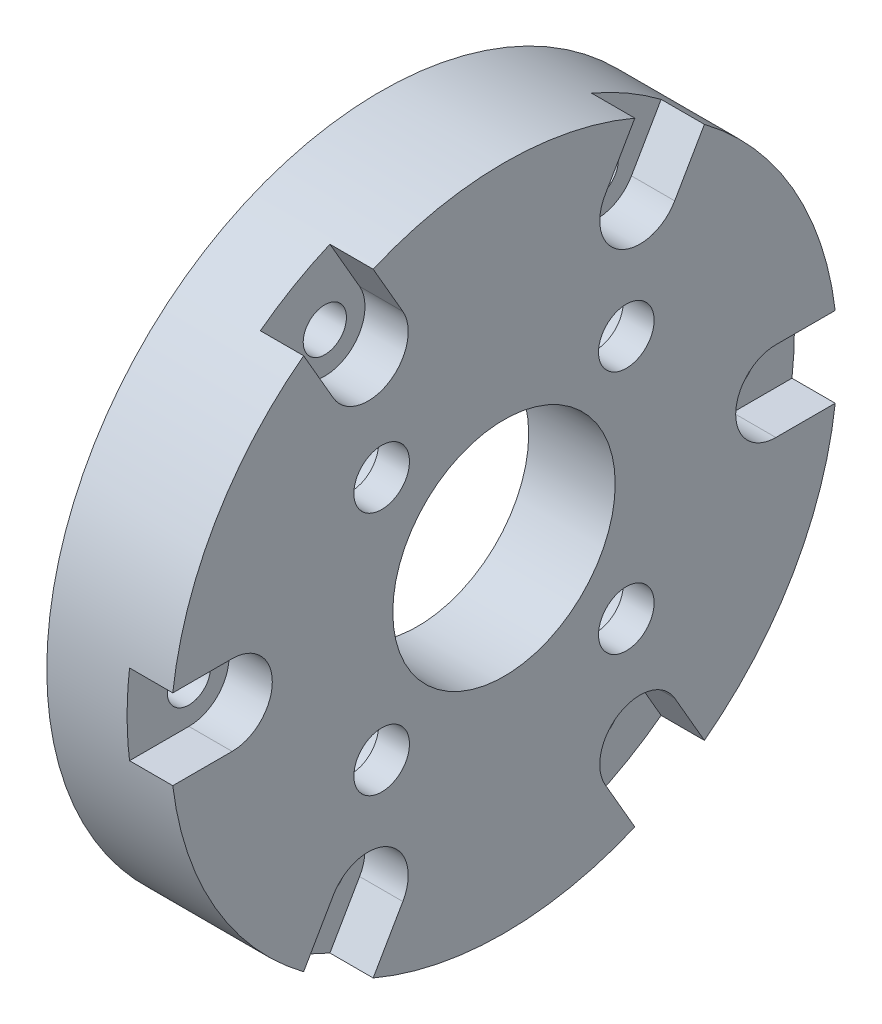
from build123d import *

# Parameters (mm, degrees)
ENL_V_MAT_EXTRU_1_DEPTH                         = 3.5
R_P_TITION_CIRCULAIRE1_COUNT                    = 6
ESQUISSE3_R                                     = 1.75
ENL_V_MAT_EXTRU_2_DEPTH                         = 39.733060814
R_P_TITION_CIRCULAIRE2_COUNT                    = 6
CHAMBRAGE_POUR_VIS_T_TE_CYLINDRIQUE_D           = 4.5
CHAMBRAGE_POUR_VIS_T_TE_CYLINDRIQUE_CBORE_D     = 8
CHAMBRAGE_POUR_VIS_T_TE_CYLINDRIQUE_CBORE_DEPTH = 4.5
R_P_TITION_CIRCULAIRE3_COUNT                    = 4


with BuildPart() as part:
    # Esquisse1 → Base-Révolution (revolve)
    with BuildSketch(Plane.XY, mode=Mode.PRIVATE) as base_r_volution_sk:
        Polygon((-5, 27), (-5, 19), (-2, 19), (-2, 9), (5, 9), (5, 27), align=None)
    revolve(base_r_volution_sk.sketch.rotate(Axis((-14.936373376, 0, 0), (1, 0, 0)), 90), axis=Axis((-14.936373376, 0, 0), (1, 0, 0)))

    # Esquisse2 → Enlèv. mat.-Extru.1 (cut)
    with BuildSketch(Plane(origin=(5, 0, 0), x_dir=(0, 0, -1), z_dir=(1, 0, 0))):
        with BuildLine():
            Line((-22, 3.25), (-28.543286321, 3.25))
            Line((-28.543286321, 3.25), (-28.543286321, -3.25))
            Line((-28.543286321, -3.25), (-22, -3.25))
            ThreePointArc((-22, -3.25), (-18.75, 0), (-22, 3.25))
        make_face()
    enl_v_mat_extru_1 = extrude(amount=-ENL_V_MAT_EXTRU_1_DEPTH, mode=Mode.SUBTRACT)

    # Répétition circulaire1: Enlèv. mat.-Extru.1 ×6 about axis
    r_p_tition_circulaire1_axis = Axis((0, 0, 0), (1, 0, 0))
    for i in range(1, R_P_TITION_CIRCULAIRE1_COUNT):
        add(enl_v_mat_extru_1.rotate(r_p_tition_circulaire1_axis, i * 360 / R_P_TITION_CIRCULAIRE1_COUNT), mode=Mode.SUBTRACT)

    # Esquisse3 → Enlèv. mat.-Extru.2 (cut, through all)
    with BuildSketch(Plane(origin=(1.5, 0, 0), x_dir=(0, 0, -1), z_dir=(1, 0, 0))):
        with Locations((-22, 0)):
            Circle(ESQUISSE3_R)
    enl_v_mat_extru_2 = extrude(amount=-ENL_V_MAT_EXTRU_2_DEPTH, mode=Mode.SUBTRACT)

    # Répétition circulaire2: Enlèv. mat.-Extru.2 ×6 about axis
    r_p_tition_circulaire2_axis = Axis((0, 0, 0), (1, 0, 0))
    for i in range(1, R_P_TITION_CIRCULAIRE2_COUNT):
        add(enl_v_mat_extru_2.rotate(r_p_tition_circulaire2_axis, i * 360 / R_P_TITION_CIRCULAIRE2_COUNT), mode=Mode.SUBTRACT)

    # Chambrage pour vis à tête cylindrique à 6 pans creux (vis CHC) M41 (through all)
    with Locations(Plane.ZY.offset(2)):
        with Locations((9.899494937, 9.899494937)):
            chambrage_pour_vis_t_te_cylindrique = CounterBoreHole(CHAMBRAGE_POUR_VIS_T_TE_CYLINDRIQUE_D / 2, CHAMBRAGE_POUR_VIS_T_TE_CYLINDRIQUE_CBORE_D / 2, CHAMBRAGE_POUR_VIS_T_TE_CYLINDRIQUE_CBORE_DEPTH)

    # Répétition circulaire3: Chambrage pour vis à tête cylindrique à 6 pans creux (vis CHC) M41 ×4 about axis
    r_p_tition_circulaire3_axis = Axis((0, 0, 0), (1, 0, 0))
    for i in range(1, R_P_TITION_CIRCULAIRE3_COUNT):
        add(chambrage_pour_vis_t_te_cylindrique.rotate(r_p_tition_circulaire3_axis, i * 360 / R_P_TITION_CIRCULAIRE3_COUNT), mode=Mode.SUBTRACT)


solid = part.part
